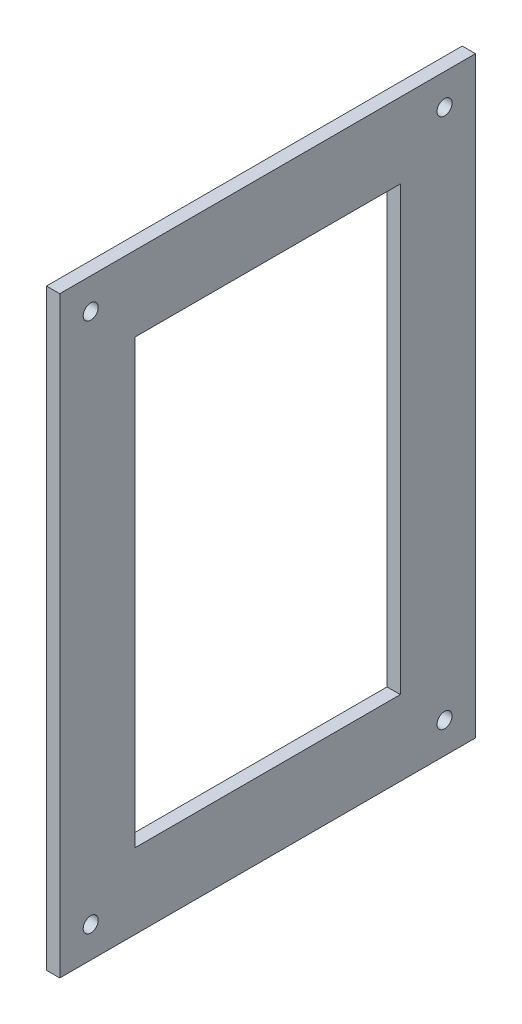
from build123d import *

# Parameters (mm, degrees)
FLANGE_START                 = 98
SKETCH1_W                    = 94
SKETCH1_H                    = 134
FLANGE_DEPTH                 = 3
PORT_AND_M3_HOLES_DEPTH      = 236.072329295
PORT_AND_M3_HOLES_DEPTH_BACK = 236.072329295
SKETCH2_R                    = 1.7
SKETCH2_W                    = 60
SKETCH2_H                    = 100


with BuildPart() as part:
    # Sketch1 → flange (new body)
    with BuildSketch(Plane(origin=(0, 0, 0), x_dir=(0, 0, -1), z_dir=(1, 0, 0)).offset(FLANGE_START)):
        with Locations((0, 140)):
            Rectangle(SKETCH1_W, SKETCH1_H)
    extrude(amount=FLANGE_DEPTH)

    # Sketch2 → Port_and_M3_holes (cut, two sides: drawn at the far end of the back side and taken through both)
    with BuildSketch(Plane(origin=(0, 0, 0), x_dir=(0, 0, -1), z_dir=(1, 0, 0)).offset(-PORT_AND_M3_HOLES_DEPTH_BACK)):
        with Locations((40, 80)):
            Circle(SKETCH2_R)
        with Locations((-40, 80)):
            Circle(SKETCH2_R)
        with Locations((40, 200)):
            Circle(SKETCH2_R)
        with Locations((-40, 200)):
            Circle(SKETCH2_R)
        with Locations((0, 140)):
            Rectangle(SKETCH2_W, SKETCH2_H)
    extrude(amount=PORT_AND_M3_HOLES_DEPTH + PORT_AND_M3_HOLES_DEPTH_BACK, mode=Mode.SUBTRACT)


solid = part.part
